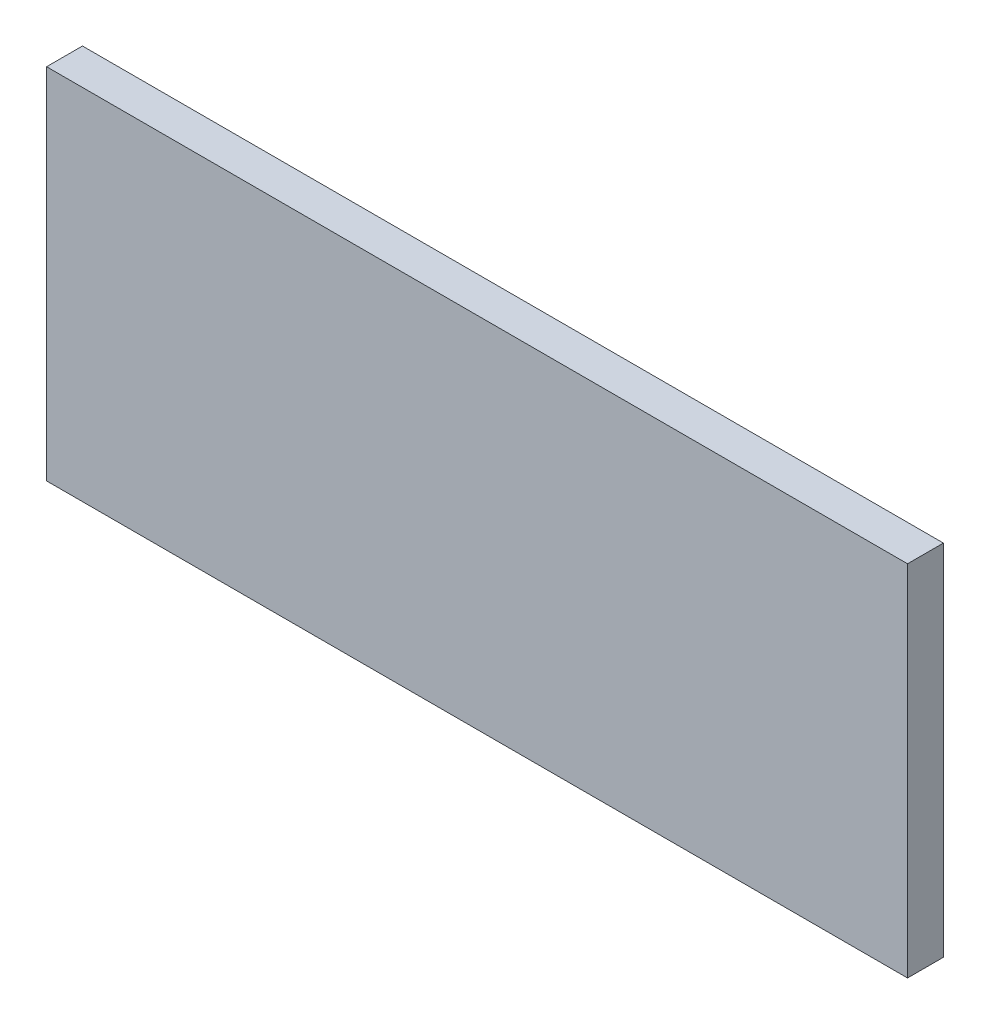
from build123d import *

# Parameters (mm, degrees)
SKETCH_1_W      = 120
SKETCH_1_H      = 50
EXTRUDE_1_DEPTH = 5


with BuildPart() as part:
    # ｽｹｯﾁ1 → ﾎﾞｽ - 押し出し1 (new body)
    with BuildSketch(Plane.XY):
        Rectangle(SKETCH_1_W, SKETCH_1_H)
    extrude(amount=EXTRUDE_1_DEPTH)


solid = part.part
